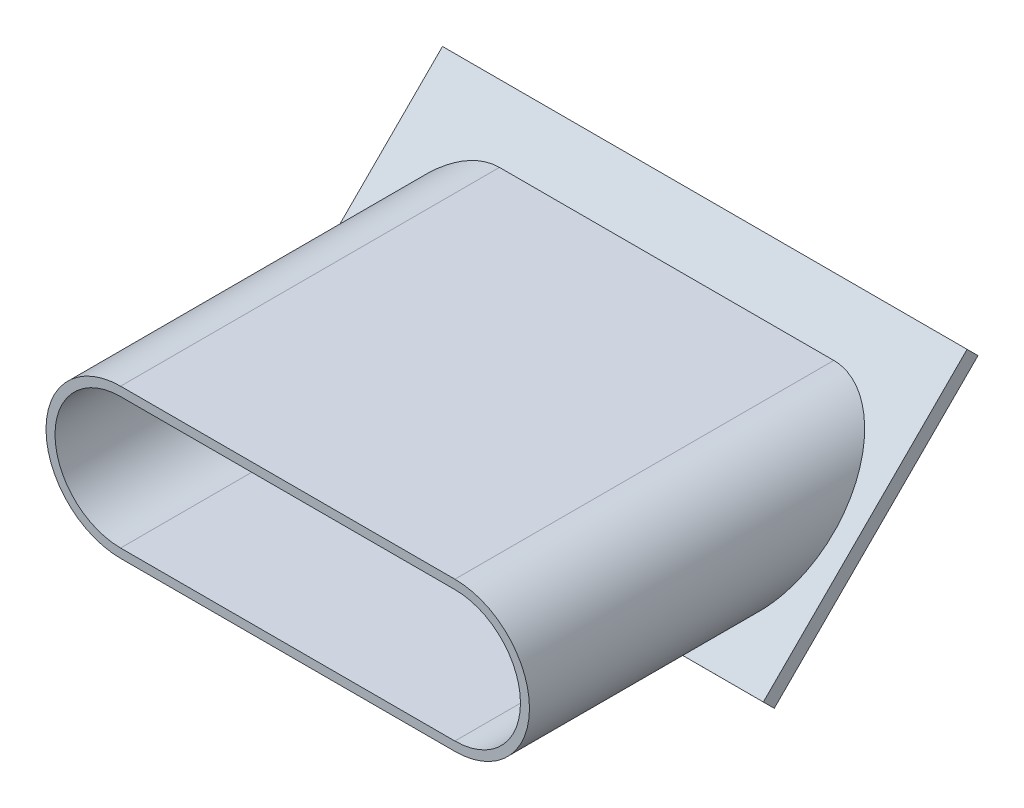
from build123d import *

# Parameters (mm, degrees)
BOSS_EXTRUDE12_DEPTH            = 80
CUT_EXTRUDE10_DEPTH             = 114.712356409
CUT_EXTRUDE10_DEPTH_BACK        = 114.712356409
SKETCH37_W                      = 102
SKETCH37_H                      = 56
BOSS_EXTRUDE16_DEPTH            = 3
CUT_EXTRUDE11_DEPTH             = 102.766059637
SKETCH40_W                      = 127.486838651
SKETCH40_H                      = 11.94281061
CUT_EXTRUDE12_DEPTH             = 102.007241851
CUT_EXTRUDE12_DIRECTION_2_REACH = 103.007


with BuildPart() as part:
    # Sketch22 → Boss-Extrude12 (new body)
    with BuildSketch(Plane.XY):
        with BuildLine():
            Line((32.5, -14.5), (-32.5, -14.5))
            ThreePointArc((-32.5, -14.5), (-47, 0), (-32.5, 14.5))
            Line((-32.5, 14.5), (32.5, 14.5))
            ThreePointArc((32.5, 14.5), (47, 0), (32.5, -14.5))
        make_face()
    extrude(amount=BOSS_EXTRUDE12_DEPTH)

    # Sketch35 → Cut-Extrude10 (cut, two sides: drawn at the far end of the back side and taken through both)
    with BuildSketch(Plane(origin=(-32.5, 0, 0), x_dir=(0, 0, -1), z_dir=(1, 0, 0)).offset(-CUT_EXTRUDE10_DEPTH_BACK)):
        Polygon((0, 14.5), (-29.026860374, -14.5), (0, -14.5), align=None)
    extrude(amount=CUT_EXTRUDE10_DEPTH + CUT_EXTRUDE10_DEPTH_BACK, mode=Mode.SUBTRACT)

    # Sketch37 → Boss-Extrude16 (add)
    with BuildSketch(Plane(origin=(0, 7.256711984, 7.249996893), x_dir=(-1, 0, 0), z_dir=(0, -0.7074340219640284, -0.7067793888957138))):
        with Locations((0, -10.26729429)):
            Rectangle(SKETCH37_W, SKETCH37_H)
    extrude(amount=-BOSS_EXTRUDE16_DEPTH)

    # Sketch38 → Cut-Extrude11 (cut, through all)
    with BuildSketch(Plane.XY.offset(80)):
        with BuildLine():
            Line((-32.5, 12.75), (32.5, 12.75))
            ThreePointArc((32.5, 12.75), (45.25, 0), (32.5, -12.75))
            Line((32.5, -12.75), (-32.5, -12.75))
            ThreePointArc((-32.5, -12.75), (-45.25, 0), (-32.5, 12.75))
        make_face()
    extrude(amount=-CUT_EXTRUDE11_DEPTH, mode=Mode.SUBTRACT)

    # Sketch40 → Cut-Extrude12 (cut)
    with BuildSketch(Plane(origin=(0, -12.75, 0), x_dir=(1, 0, 0), z_dir=(0, 1, 0))):
        with Locations((5.984726224, -83.886766037)):
            Rectangle(SKETCH40_W, SKETCH40_H)
    extrude(amount=CUT_EXTRUDE12_DEPTH, mode=Mode.SUBTRACT)

    # Cut-Extrude12 direction 2: up to this face of the body (flat: up to its plane)
    cut_extrude12_direction_2_end = Plane(part.part.faces().sort_by_distance((0, -14.5, 56.635733163))[0])
    # Sketch40 → Cut-Extrude12 direction 2 (cut, up to the picked face)
    with BuildSketch(Plane(origin=(0, -12.75, 0), x_dir=(1, 0, 0), z_dir=(0, 1, 0)), mode=Mode.PRIVATE) as cut_extrude12_direction_2_sk1:
        with Locations((5.984726224, -83.886766037)):
            Rectangle(SKETCH40_W, SKETCH40_H)
    cut_extrude12_direction_2_tool1 = split(extrude(cut_extrude12_direction_2_sk1.sketch, amount=-CUT_EXTRUDE12_DIRECTION_2_REACH, mode=Mode.PRIVATE), bisect_by=cut_extrude12_direction_2_end, keep=Keep.BOTH, mode=Mode.PRIVATE)
    add(cut_extrude12_direction_2_tool1.solids().sort_by(Axis((5.984726, -12.75, 83.886766), (0, -1, 0)))[0], mode=Mode.SUBTRACT)


solid = part.part
